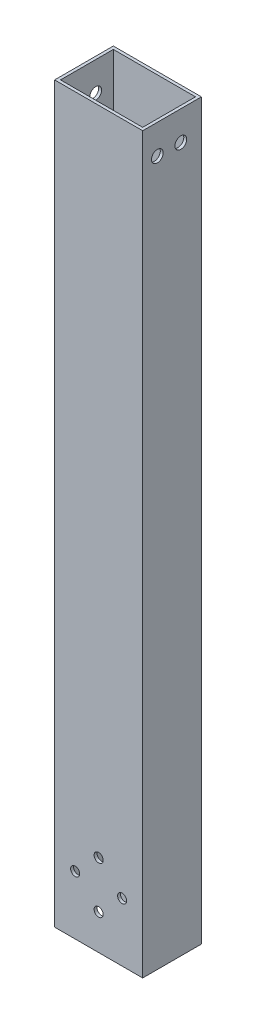
from build123d import *

# Parameters (mm, degrees)
SKETCH_1_W               = 30
SKETCH_1_H               = 20
SKETCH_1_W_2             = 28
SKETCH_1_H_2             = 18
EXTRUDE_1_DEPTH          = 250
CUT_EXTRUDE_1_DEPTH      = 251.64915719
CUT_EXTRUDE_1_DEPTH_BACK = 251.64915719
SKETCH_2_R               = 1.55
CUT_EXTRUDE_2_DEPTH      = 251.64915719
CUT_EXTRUDE_2_DEPTH_BACK = 251.64915719
SKETCH_3_R               = 2


with BuildPart() as part:
    # 草图1 → 凸台-拉伸1 (new body)
    with BuildSketch(Plane(origin=(0, 0, 0), x_dir=(1, 0, 0), z_dir=(0, 1, 0))):
        Rectangle(SKETCH_1_W, SKETCH_1_H)
        Rectangle(SKETCH_1_W_2, SKETCH_1_H_2, mode=Mode.SUBTRACT)
    extrude(amount=EXTRUDE_1_DEPTH)

    # 草图2 → 切除-拉伸1 (cut, two sides: drawn at the far end of the back side and taken through both)
    with BuildSketch(Plane.XY.offset(-CUT_EXTRUDE_1_DEPTH_BACK)):
        with Locations((0, 28)):
            Circle(SKETCH_2_R)
        with Locations((8, 20)):
            Circle(SKETCH_2_R)
        with Locations((0, 12)):
            Circle(SKETCH_2_R)
        with Locations((-8, 20)):
            Circle(SKETCH_2_R)
    extrude(amount=CUT_EXTRUDE_1_DEPTH + CUT_EXTRUDE_1_DEPTH_BACK, mode=Mode.SUBTRACT)

    # 草图3 → 切除-拉伸2 (cut, two sides: drawn at the far end of the back side and taken through both)
    with BuildSketch(Plane(origin=(0, 0, 0), x_dir=(0, 0, -1), z_dir=(1, 0, 0)).offset(-CUT_EXTRUDE_2_DEPTH_BACK)):
        with Locations((-5, 240)):
            Circle(SKETCH_3_R)
        with Locations((3, 240)):
            Circle(SKETCH_3_R)
    extrude(amount=CUT_EXTRUDE_2_DEPTH + CUT_EXTRUDE_2_DEPTH_BACK, mode=Mode.SUBTRACT)


solid = part.part
